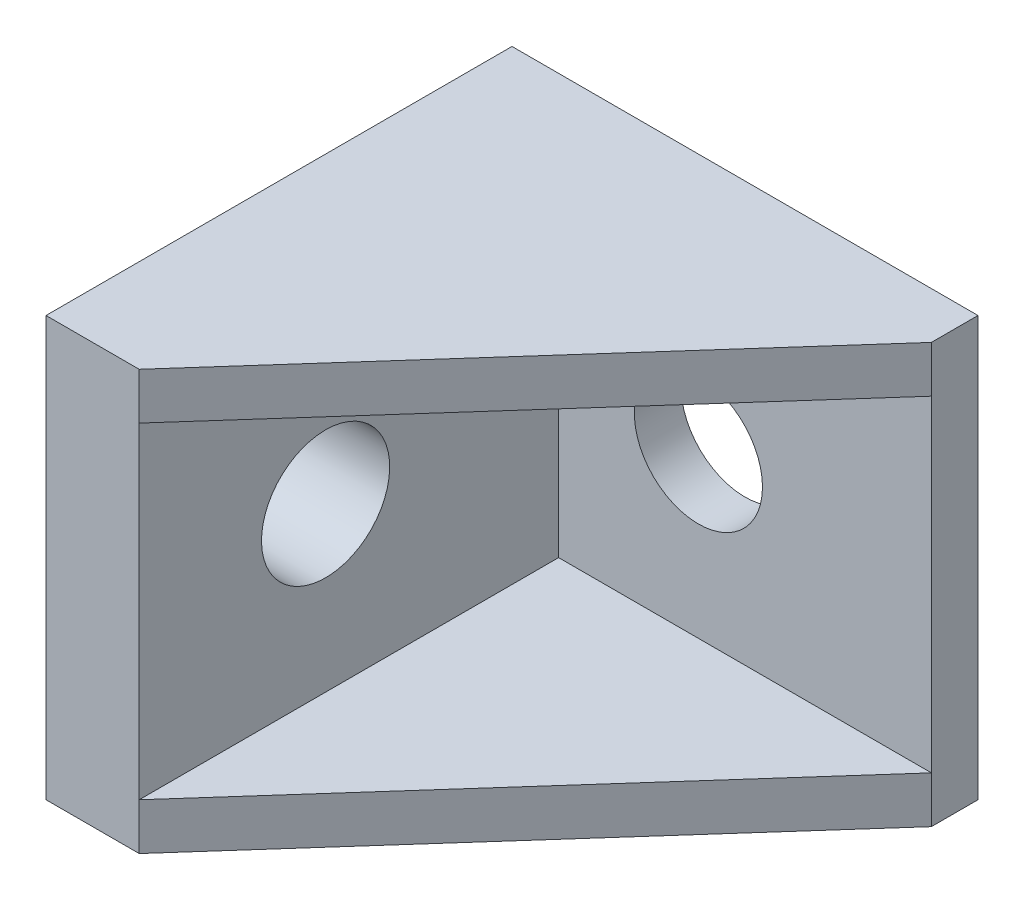
from build123d import *

# Parameters (mm, degrees)
SKETCH_1_W               = 20
SKETCH_1_H               = 18
EXTRUDE_1_DEPTH          = 20
SKETCH_2_W               = 16
SKETCH_2_H               = 14
CUT_EXTRUDE_1_DEPTH      = 18
CUT_EXTRUDE_2_DEPTH      = 28.49545417
CUT_EXTRUDE_2_DEPTH_BACK = 28.49545417
CUT_EXTRUDE_3_DEPTH      = 23.472205054
CUT_EXTRUDE_3_DEPTH_BACK = 23.472205054
SKETCH_5_R               = 2.75
CUT_EXTRUDE_4_DEPTH      = 28.147743921
CUT_EXTRUDE_4_DEPTH_BACK = 28.147743921
SKETCH_6_R               = 2.75


with BuildPart() as part:
    # 스케치1 → 보스-돌출1 (new body)
    with BuildSketch(Plane.XY):
        Rectangle(SKETCH_1_W, SKETCH_1_H)
    extrude(amount=EXTRUDE_1_DEPTH)

    # 스케치2 → 컷-돌출1 (cut)
    with BuildSketch(Plane.XY.offset(20)):
        with Locations((2, 0)):
            Rectangle(SKETCH_2_W, SKETCH_2_H)
    extrude(amount=-CUT_EXTRUDE_1_DEPTH, mode=Mode.SUBTRACT)

    # 스케치4 → 컷-돌출2 (cut, two sides: drawn at the far end of the back side and taken through both)
    with BuildSketch(Plane(origin=(0, -7, 0), x_dir=(1, 0, 0), z_dir=(0, 1, 0)).offset(-CUT_EXTRUDE_2_DEPTH_BACK)):
        Polygon((-6, -20), (10, -2), (10, -20), align=None)
    extrude(amount=CUT_EXTRUDE_2_DEPTH + CUT_EXTRUDE_2_DEPTH_BACK, mode=Mode.SUBTRACT)

    # 스케치5 → 컷-돌출3 (cut, two sides: drawn at the far end of the back side and taken through both)
    with BuildSketch(Plane.XY.offset(2).offset(-CUT_EXTRUDE_3_DEPTH_BACK)):
        Circle(SKETCH_5_R)
    extrude(amount=CUT_EXTRUDE_3_DEPTH + CUT_EXTRUDE_3_DEPTH_BACK, mode=Mode.SUBTRACT)

    # 스케치6 → 컷-돌출4 (cut, two sides: drawn at the far end of the back side and taken through both)
    with BuildSketch(Plane(origin=(-6, 0, 0), x_dir=(0, 0, -1), z_dir=(1, 0, 0)).offset(-CUT_EXTRUDE_4_DEPTH_BACK)):
        with Locations(Location((-12, 0, 0), (0, 0, 90))):
            Circle(SKETCH_6_R)
    extrude(amount=CUT_EXTRUDE_4_DEPTH + CUT_EXTRUDE_4_DEPTH_BACK, mode=Mode.SUBTRACT)


solid = part.part
